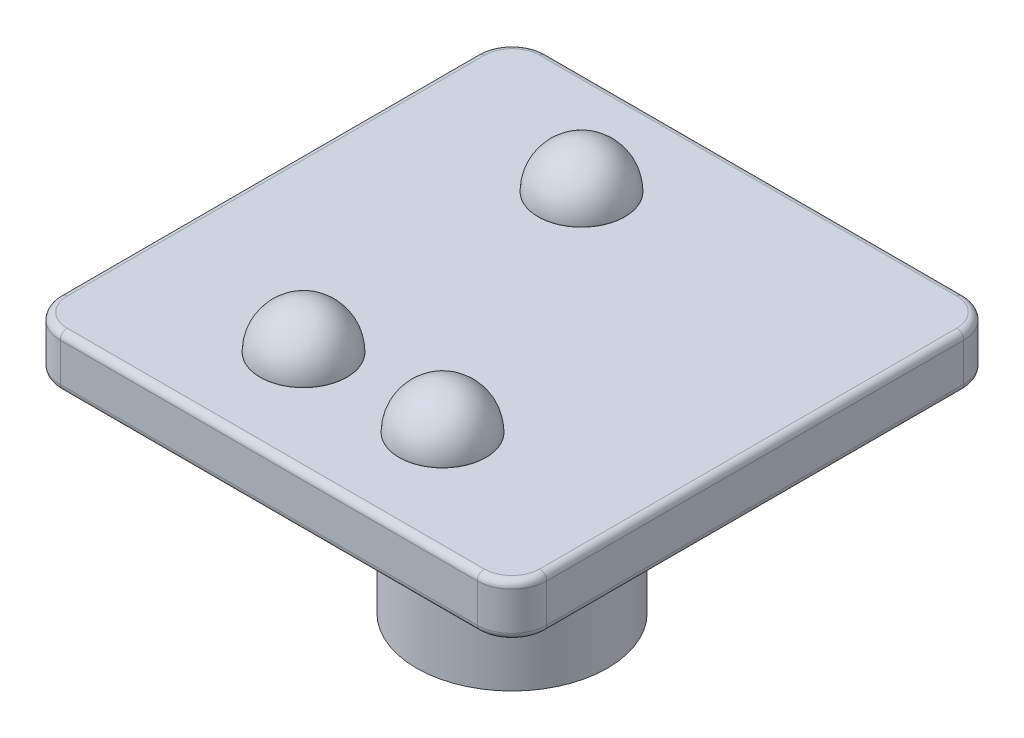
from build123d import *

# Parameters (mm, degrees)
BOSS_EXTRUDE1_DEPTH = 1.5
SKETCH2_R           = 2.75
BOSS_EXTRUDE2_DEPTH = 6
SKETCH3_W           = 1.1
SKETCH3_H           = 1.45
SKETCH3_W_2         = 1.45
SKETCH3_H_2         = 1.1
CUT_EXTRUDE1_DEPTH  = 6
CHAMFER1_SIZE       = 0.3
FILLET1_R           = 1
SKETCH4_R           = 1.25
BOSS_EXTRUDE3_DEPTH = 0.01
DOME1_FACE_RADIUS   = 1.25
DOME1_HEIGHT        = 1.25
DOME5_FACE_RADIUS   = 1.25
DOME5_HEIGHT        = 1.25
DOME6_FACE_RADIUS   = 1.25
DOME6_HEIGHT        = 1.25
FILLET3_R           = 0.2


with BuildPart() as part:
    # Sketch1 → Boss-Extrude1 (new body)
    with BuildSketch(Plane(origin=(0, 0, 0), x_dir=(1, 0, 0), z_dir=(0, 1, 0))):
        with BuildLine():
            Line((-7.324675649, 4.396717546), (4.675324351, 4.396717546))
            ThreePointArc((4.675324351, 4.396717546), (5.382431132, 4.103824327), (5.675324351, 3.396717546))
            Line((5.675324351, 3.396717546), (5.675324351, -8.603282454))
            ThreePointArc((5.675324351, -8.603282454), (5.382431132, -9.310389235), (4.675324351, -9.603282454))
            Line((4.675324351, -9.603282454), (-7.324675649, -9.603282454))
            ThreePointArc((-7.324675649, -9.603282454), (-8.03178243, -9.310389235), (-8.324675649, -8.603282454))
            Line((-8.324675649, -8.603282454), (-8.324675649, 3.396717546))
            ThreePointArc((-8.324675649, 3.396717546), (-8.03178243, 4.103824327), (-7.324675649, 4.396717546))
        make_face()
    extrude(amount=BOSS_EXTRUDE1_DEPTH)

    # Sketch2 → Boss-Extrude2 (add)
    with BuildSketch(Plane.XZ):
        with Locations(Location((-1.324675649, 2.603282454, 0), (0, 0, 270))):
            Circle(SKETCH2_R)
    extrude(amount=BOSS_EXTRUDE2_DEPTH)

    # Sketch3 → Cut-Extrude1 (cut)
    with BuildSketch(Plane.XZ.offset(6)):
        with Locations((-1.324675649, 3.878282454)):
            Rectangle(SKETCH3_W, SKETCH3_H)
        with Locations((-0.049675649, 2.603282454)):
            Rectangle(SKETCH3_W_2, SKETCH3_H_2)
        with Locations((-1.324675649, 2.603282454)):
            Rectangle(SKETCH3_W, SKETCH3_H_2)
        with Locations((-2.599675649, 2.603282454)):
            Rectangle(SKETCH3_W_2, SKETCH3_H_2)
        with Locations((-1.324675649, 1.328282454)):
            Rectangle(SKETCH3_W, SKETCH3_H)
    extrude(amount=-CUT_EXTRUDE1_DEPTH, mode=Mode.SUBTRACT)

    # Chamfer1
    chamfer1_edges = [part.edges().sort_by_distance(p)[0] for p in [
        (-0.774675649, -6, 3.878282454),
        (-0.049675649, -6, 3.153282454),
        (0.675324351, -6, 2.603282454),
        (-0.774675649, -6, 1.328282454),
        (-2.599675649, -6, 3.153282454),
        (-1.324675649, -6, 4.603282454),
        (-1.874675649, -6, 3.878282454),
        (-3.324675649, -6, 2.603282454),
        (-2.599675649, -6, 2.053282454),
        (-1.874675649, -6, 1.328282454),
        (-1.324675649, -6, 0.603282454),
        (-0.049675649, -6, 2.053282454),
    ]]
    chamfer(chamfer1_edges, length=CHAMFER1_SIZE)

    # Fillet1
    fillet1_edges = [part.edges().sort_by_distance(p)[0] for p in [
        (-1.324675649, 0, 5.353282454),
    ]]
    fillet(fillet1_edges, radius=FILLET1_R)

    # Sketch4 → Boss-Extrude3 (add)
    with BuildSketch(Plane(origin=(0, 1.5, 0), x_dir=(1, 0, 0), z_dir=(0, 1, 0))):
        with Locations(Location((-3.324675649, 1.396717546, 0), (0, 0, 90))):
            Circle(SKETCH4_R)
        with Locations(Location((-3.324675649, -6.603282454, 0), (0, 0, 90))):
            Circle(SKETCH4_R)
        with Locations(Location((0.675324351, -6.603282454, 0), (0, 0, 90))):
            Circle(SKETCH4_R)
    extrude(amount=BOSS_EXTRUDE3_DEPTH)

    # Dome1: a dome of height H over a round flat face of radius A is a cap of a sphere of radius (A * A + H * H) / (2 * H)
    dome1_r = (DOME1_FACE_RADIUS * DOME1_FACE_RADIUS + DOME1_HEIGHT * DOME1_HEIGHT) / (2 * DOME1_HEIGHT)
    dome1_base = Plane((-3.324675649, 1.51, -1.396717546), z_dir=(0, 1, 0))
    with Locations(dome1_base.offset(DOME1_HEIGHT - dome1_r)):
        dome1_ball = Sphere(dome1_r, mode=Mode.PRIVATE)
    add(split(dome1_ball, bisect_by=dome1_base, keep=Keep.TOP, mode=Mode.PRIVATE))

    # Dome5: a dome of height H over a round flat face of radius A is a cap of a sphere of radius (A * A + H * H) / (2 * H)
    dome5_r = (DOME5_FACE_RADIUS * DOME5_FACE_RADIUS + DOME5_HEIGHT * DOME5_HEIGHT) / (2 * DOME5_HEIGHT)
    dome5_base = Plane((-3.324675649, 1.51, 6.603282454), z_dir=(0, 1, 0))
    with Locations(dome5_base.offset(DOME5_HEIGHT - dome5_r)):
        dome5_ball = Sphere(dome5_r, mode=Mode.PRIVATE)
    add(split(dome5_ball, bisect_by=dome5_base, keep=Keep.TOP, mode=Mode.PRIVATE))

    # Dome6: a dome of height H over a round flat face of radius A is a cap of a sphere of radius (A * A + H * H) / (2 * H)
    dome6_r = (DOME6_FACE_RADIUS * DOME6_FACE_RADIUS + DOME6_HEIGHT * DOME6_HEIGHT) / (2 * DOME6_HEIGHT)
    dome6_base = Plane((0.675324351, 1.51, 6.603282454), z_dir=(0, 1, 0))
    with Locations(dome6_base.offset(DOME6_HEIGHT - dome6_r)):
        dome6_ball = Sphere(dome6_r, mode=Mode.PRIVATE)
    add(split(dome6_ball, bisect_by=dome6_base, keep=Keep.TOP, mode=Mode.PRIVATE))

    # Fillet3
    fillet3_edges = [part.edges().sort_by_distance(p)[0] for p in [
        (5.382431132, 1.5, 9.310389235),
        (-1.324675649, 0, 9.603282454),
        (-8.03178243, 0, 9.310389235),
        (5.675324351, 1.5, 2.603282454),
        (5.382431132, 1.5, -4.103824327),
        (-1.324675649, 1.5, -4.396717546),
        (-8.03178243, 1.5, -4.103824327),
        (-8.324675649, 1.5, 2.603282454),
        (-8.03178243, 1.5, 9.310389235),
        (-1.324675649, 1.5, 9.603282454),
        (-8.324675649, 0, 2.603282454),
        (-8.03178243, 0, -4.103824327),
        (-1.324675649, 0, -4.396717546),
        (5.382431132, 0, -4.103824327),
        (5.675324351, 0, 2.603282454),
        (5.382431132, 0, 9.310389235),
    ]]
    fillet(fillet3_edges, radius=FILLET3_R)


solid = part.part
